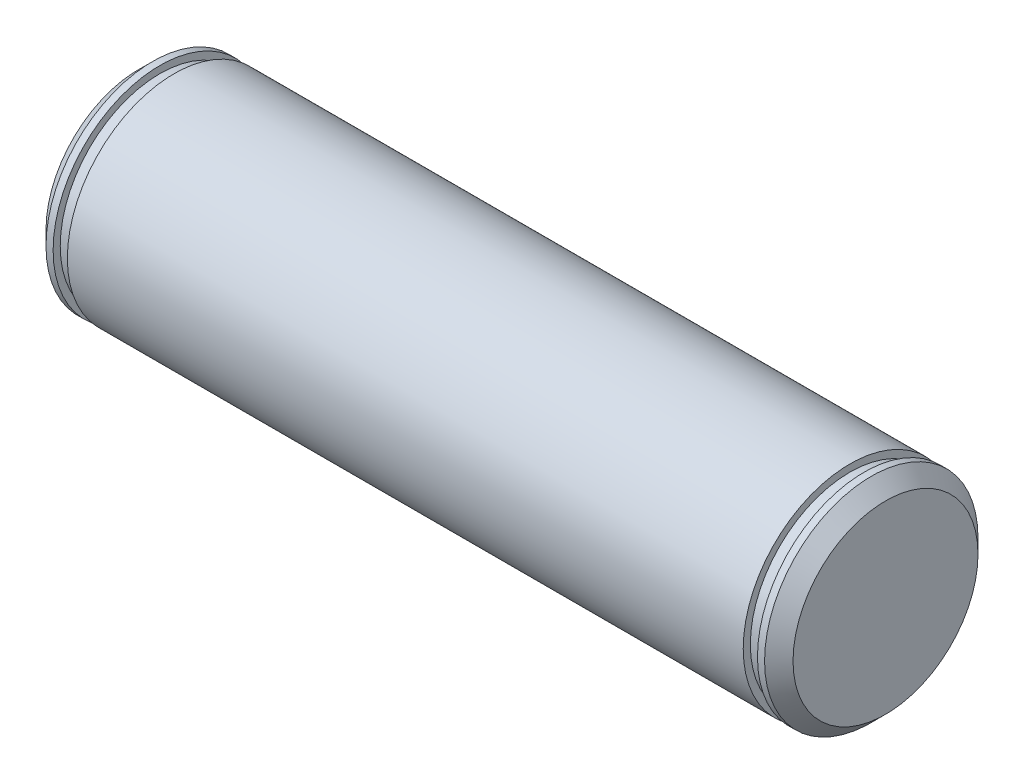
from build123d import *


with BuildPart() as part:
    # Sketch1 → Revolve1 (revolve)
    with BuildSketch(Plane.XY, mode=Mode.PRIVATE) as revolve1_sk:
        Polygon((-52.5, 0), (52.5, 0), (52.5, 13), (50.5, 15), (49.5, 15), (49.5, 14), (47.5, 14), (47.5, 15), (-47.5, 15), (-47.5, 14), (-49.5, 14), (-49.5, 15), (-50.5, 15), (-52.5, 13), align=None)
    revolve(revolve1_sk.sketch.rotate(Axis((0, 0, 0), (1, 0, 0)), 90), axis=Axis((0, 0, 0), (1, 0, 0)))


solid = part.part
